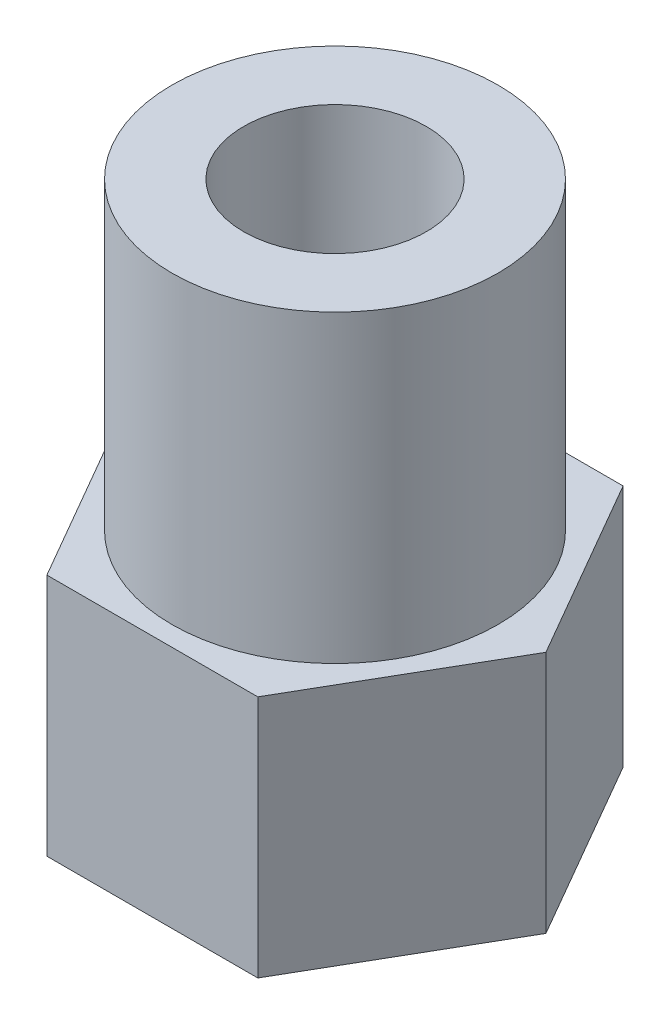
from build123d import *

# Parameters (mm, degrees)
BOSS_EXTRUDE1_DEPTH = 8
SKETCH3_R           = 5.355206435
BOSS_EXTRUDE2_DEPTH = 10
SKETCH4_R           = 3
CUT_EXTRUDE1_DEPTH  = 20


with BuildPart() as part:
    # Sketch2 → Boss-Extrude1 (new body)
    with BuildSketch(Plane(origin=(0, 0, 0), x_dir=(1, 0, 0), z_dir=(0, 1, 0))):
        Polygon((3.465, 6.001556048), (-3.465, 6.001556048), (-6.93, 0), (-3.465, -6.001556048), (3.465, -6.001556048), (6.93, 0), align=None)
    extrude(amount=BOSS_EXTRUDE1_DEPTH)

    # Sketch3 → Boss-Extrude2 (add)
    with BuildSketch(Plane(origin=(0, 8, 0), x_dir=(1, 0, 0), z_dir=(0, 1, 0))):
        with Locations(Location((0, 0, 0), (0, 0, 270))):
            Circle(SKETCH3_R)
    extrude(amount=BOSS_EXTRUDE2_DEPTH)

    # Sketch4 → Cut-Extrude1 (cut)
    with BuildSketch(Plane(origin=(0, 18, 0), x_dir=(1, 0, 0), z_dir=(0, 1, 0))):
        with Locations(Location((0, 0, 0), (0, 0, 270))):
            Circle(SKETCH4_R)
    extrude(amount=-CUT_EXTRUDE1_DEPTH, mode=Mode.SUBTRACT)


solid = part.part
